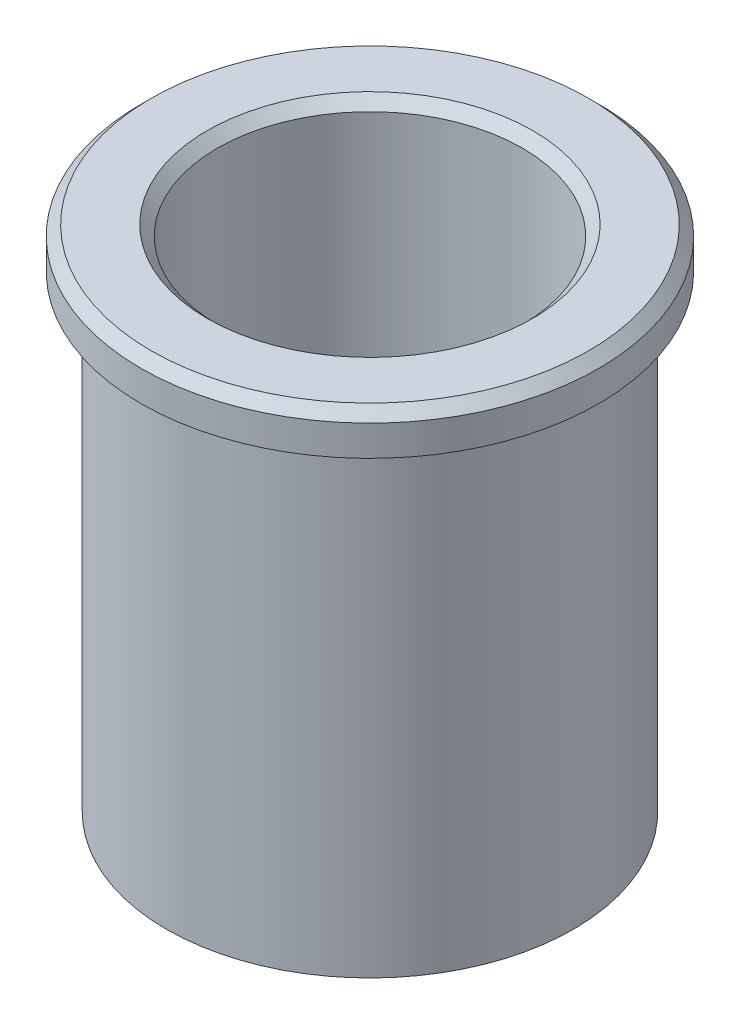
from build123d import *


with BuildPart() as part:
    # Esquisse1 → Révolution1 (revolve)
    with BuildSketch(Plane.XY, mode=Mode.PRIVATE) as r_volution1_sk:
        Polygon((16, 0), (21.5, 0), (22.5, -1), (22.5, -4), (20, -4), (20, -50), (16, -50), (15, -49), (15, -1), align=None)
    revolve(r_volution1_sk.sketch.rotate(Axis((0, 22.616438356, 0), (0, -1, 0)), 90), axis=Axis((0, 22.616438356, 0), (0, -1, 0)))


solid = part.part
